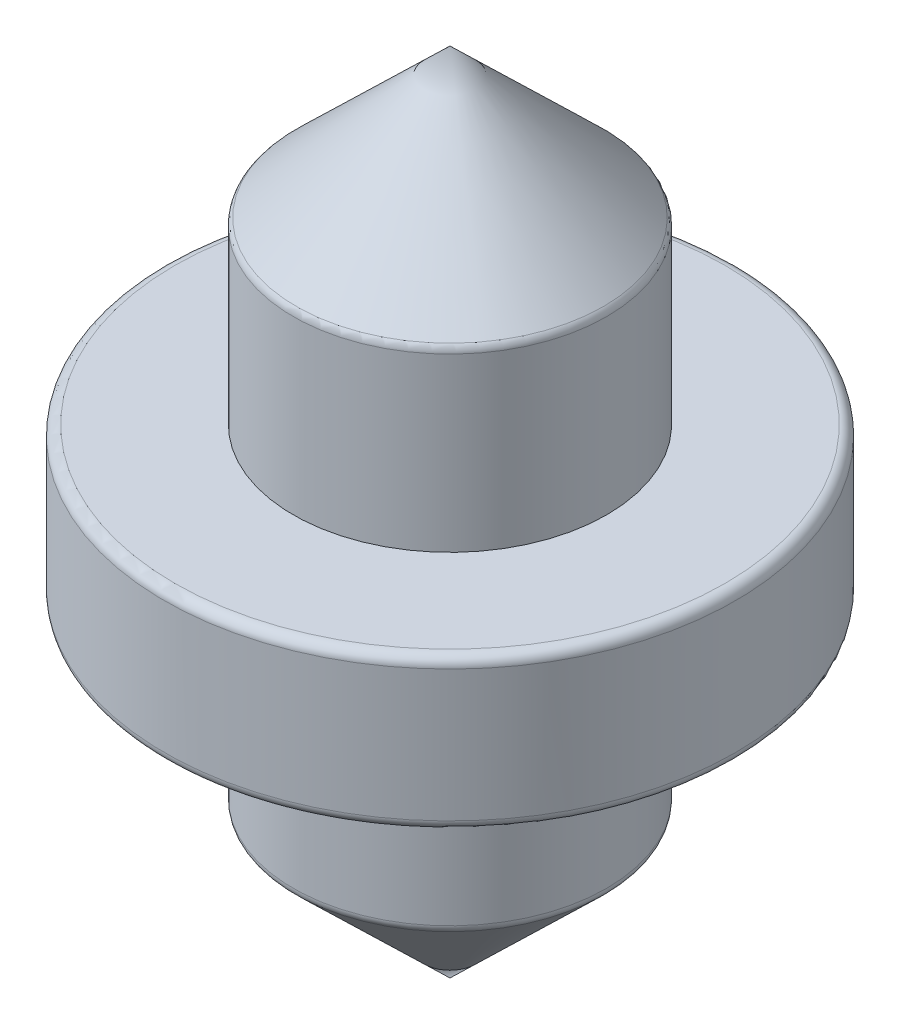
from build123d import *

# Parameters (mm, degrees)
FILLET_1_R = 2
FILLET_2_R = 2
FILLET_3_R = 2
FILLET_4_R = 2


with BuildPart() as part:
    # 草图1 → 旋转1 (revolve)
    with BuildSketch(Plane.XY):
        Polygon((0, 70.055695547), (0, -29.530111316), (-30.991998015, -29.530111316), (-30.991998015, 5.262792116), (-56.428826574, 5.262792116), (-56.428826574, 35.262792116), (-30.991998015, 35.262792116), (-30.991998015, 70.055695547), align=None)
        Polygon((0, 100.055695547), (0, 70.055695547), (-30.991998015, 70.055695547), align=None)
        Polygon((0, -29.530111316), (0, -59.530111316), (-30.991998015, -29.530111316), align=None)
    revolve(axis=Axis((0, 70.055695547, 0), (0, -1, 0)))

    # 圆角1
    fillet_1_edges = [part.edges().sort_by_distance(p)[0] for p in [
        (56.428826574, 35.262792116, 0),
    ]]
    fillet(fillet_1_edges, radius=FILLET_1_R)

    # 圆角2
    fillet_2_edges = [part.edges().sort_by_distance(p)[0] for p in [
        (56.428826574, 5.262792116, 0),
    ]]
    fillet(fillet_2_edges, radius=FILLET_2_R)

    # 圆角3
    fillet_3_edges = [part.edges().sort_by_distance(p)[0] for p in [
        (30.991998015, 70.055695547, 0),
    ]]
    fillet(fillet_3_edges, radius=FILLET_3_R)

    # 圆角4
    fillet_4_edges = [part.edges().sort_by_distance(p)[0] for p in [
        (30.991998015, -29.530111316, 0),
    ]]
    fillet(fillet_4_edges, radius=FILLET_4_R)


solid = part.part
